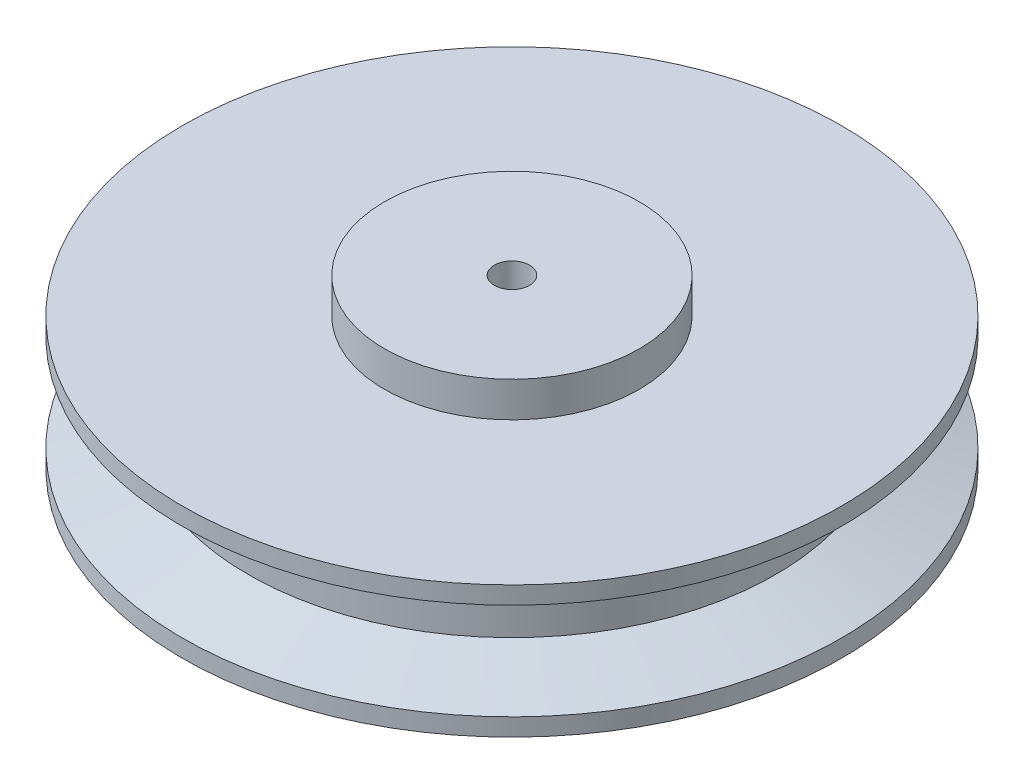
from build123d import *


with BuildPart() as part:
    # Sketch1 → Revolve1 (revolve)
    with BuildSketch(Plane.XY, mode=Mode.PRIVATE) as revolve1_sk:
        Polygon((4, 0), (4, -29.615810302), (75, -29.615810302), (75, -25.615810302), (60, -20.615810302), (60, -8.615810302), (75, -3.615810302), (75, 0.384189698), (29, 0.384189698), (29, 8.384189698), (4, 8.384189698), align=None)
    revolve(revolve1_sk.sketch.rotate(Axis((0, 0, 0), (0, -1, 0)), 180), axis=Axis((0, 0, 0), (0, -1, 0)))


solid = part.part
